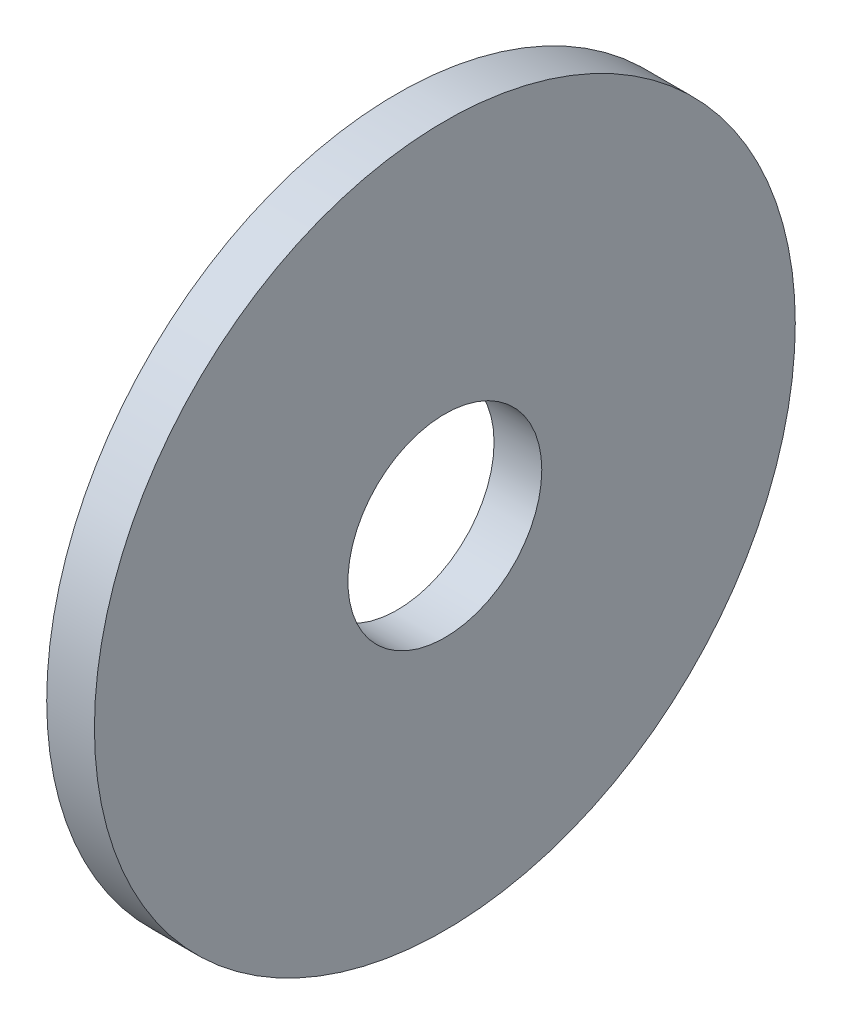
from build123d import *

# Parameters (mm, degrees)
SKETCH2_R           = 9.3265625
SKETCH2_R_2         = 2.5796875
BOSS_EXTRUDE1_DEPTH = 1.27


with BuildPart() as part:
    # Sketch2 → Boss-Extrude1 (new body)
    with BuildSketch(Plane(origin=(0, 0, 0), x_dir=(0, 0, -1), z_dir=(1, 0, 0))):
        Circle(SKETCH2_R)
        Circle(SKETCH2_R_2, mode=Mode.SUBTRACT)
    extrude(amount=BOSS_EXTRUDE1_DEPTH)


solid = part.part
